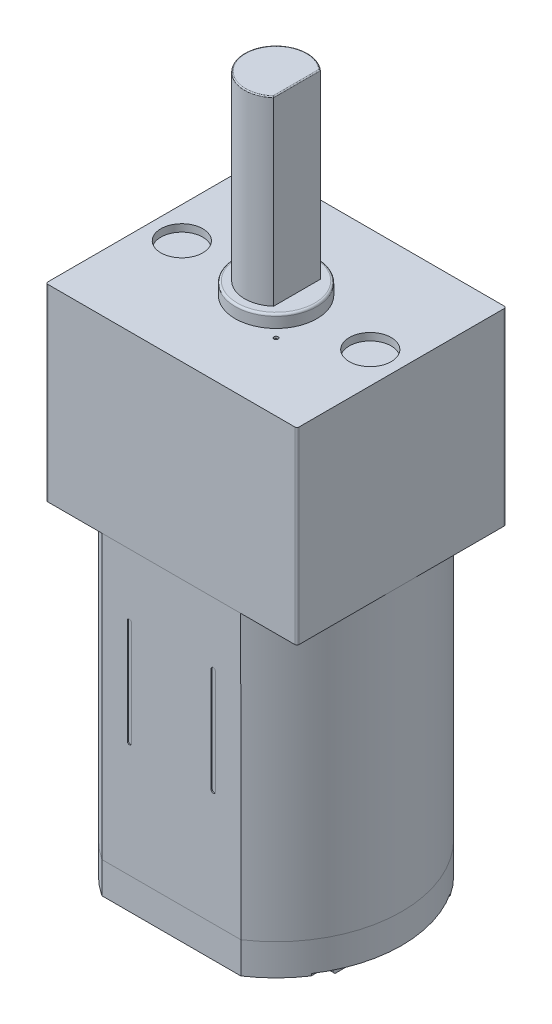
from build123d import *

# Parameters (mm, degrees)
EXTRUDE_1_DEPTH     = 13.5
SKETCH_2_W          = 12
SKETCH_2_H          = 10
EXTRUDE_2_DEPTH     = 9
SKETCH_3_R          = 1.95
EXTRUDE_3_DEPTH     = 0.6
EXTRUDE_4_DEPTH     = 8.67
SKETCH_5_R          = 1
CUT_EXTRUDE_1_DEPTH = 0.35
FILLET_1_R          = 0.1
EXTRUDE_6_DEPTH     = 1.4
EXTRUDE_START       = 0.1
EXTRUDE_7_DEPTH     = 0.1
SKETCH_8_W          = 0.3
SKETCH_8_H          = 1.5
EXTRUDE_8_DEPTH     = 2
CHAMFER_1_SIZE      = 0.1
SKETCH_9_R          = 0.4
CUT_EXTRUDE_2_DEPTH = 7
SKETCH_10_R         = 2.5
EXTRUDE_9_DEPTH     = 2
FILLET_2_R          = 0.2
SKETCH_11_R         = 0.1
CUT_EXTRUDE_3_DEPTH = 0.7
FILLET_3_R          = 0.1
CUT_EXTRUDE_4_DEPTH = 0.05
FILLET_4_R          = 0.05
FILLET_5_R          = 0.1


with BuildPart() as part:
    # Эскиз1 → Бобышка-Вытянуть1 (new body)
    with BuildSketch(Plane(origin=(0, 0, 0), x_dir=(1, 0, 0), z_dir=(0, 1, 0))):
        with BuildLine():
            Line((-3.31662479, 5), (3.31662479, 5))
            ThreePointArc((3.31662479, 5), (6, 0), (3.31662479, -5))
            Line((3.31662479, -5), (-3.31662479, -5))
            ThreePointArc((-3.31662479, -5), (-6, 0), (-3.31662479, 5))
        make_face()
    extrude(amount=EXTRUDE_1_DEPTH)

    # Эскиз2 → Бобышка-Вытянуть2 (add)
    with BuildSketch(Plane(origin=(0, 13.5, 0), x_dir=(1, 0, 0), z_dir=(0, 1, 0))):
        with Locations((0, -0.001677367)):
            Rectangle(SKETCH_2_W, SKETCH_2_H)
    extrude(amount=EXTRUDE_2_DEPTH)

    # Эскиз3 → Бобышка-Вытянуть3 (add)
    with BuildSketch(Plane(origin=(0, 22.5, 0), x_dir=(1, 0, 0), z_dir=(0, 1, 0))):
        with Locations(Location((0, 0, 0), (0, 0, 270))):
            Circle(SKETCH_3_R)
    extrude(amount=EXTRUDE_3_DEPTH)

    # Эскиз4 → Бобышка-Вытянуть4 (add)
    with BuildSketch(Plane(origin=(0, 23.1, 0), x_dir=(1, 0, 0), z_dir=(0, 1, 0))):
        with BuildLine():
            Line((1, 1.118033989), (1, -1.118033989))
            ThreePointArc((1, -1.118033989), (-1.5, 0), (1, 1.118033989))
        make_face()
    extrude(amount=EXTRUDE_4_DEPTH)

    # Эскиз5 → Вырез-Вытянуть1 (cut)
    with BuildSketch(Plane(origin=(0, 22.5, 0), x_dir=(1, 0, 0), z_dir=(0, 1, 0))):
        with Locations(Location((-4.5, 0, 0), (0, 0, 270))):
            Circle(SKETCH_5_R)
        with Locations(Location((4.5, 0, 0), (0, 0, 90))):
            Circle(SKETCH_5_R)
    extrude(amount=-CUT_EXTRUDE_1_DEPTH, mode=Mode.SUBTRACT)

    # Скругление1
    fillet_1_edges = [part.edges().sort_by_distance(p)[0] for p in [
        (-6, 18, 5.001677367),
        (6, 18, 5.001677367),
        (6, 18, -4.998322633),
        (-6, 18, -4.998322633),
    ]]
    fillet(fillet_1_edges, radius=FILLET_1_R)

    # Эскиз11 → Вырез-Вытянуть3 (cut)
    with BuildSketch(Plane(origin=(0, 23.1, 0), x_dir=(1, 0, 0), z_dir=(0, 1, 0))):
        with Locations(Location((1.767766953, -1.767766953, 0), (0, 0, 270))):
            Circle(SKETCH_11_R)
        with Locations(Location((-1.767766953, 1.767766953, 0), (0, 0, 270))):
            Circle(SKETCH_11_R)
    extrude(amount=-CUT_EXTRUDE_3_DEPTH, mode=Mode.SUBTRACT)

    # Эскиз12 → Вырез-Вытянуть4 (cut)
    with BuildSketch(Plane(origin=(0, 0, -5), x_dir=(-1, 0, 0), z_dir=(0, 0, -1))):
        with BuildLine():
            Line((1.9, 5.5), (1.9, 10.5))
            ThreePointArc((1.9, 10.5), (2, 10.6), (2.1, 10.5))
            Line((2.1, 10.5), (2.1, 5.5))
            ThreePointArc((2.1, 5.5), (2, 5.4), (1.9, 5.5))
        make_face()
        with BuildLine():
            Line((-2.1, 5.5), (-2.1, 10.5))
            ThreePointArc((-2.1, 10.5), (-2, 10.6), (-1.9, 10.5))
            Line((-1.9, 10.5), (-1.9, 5.5))
            ThreePointArc((-1.9, 5.5), (-2, 5.4), (-2.1, 5.5))
        make_face()
    cut_extrude_4 = extrude(amount=-CUT_EXTRUDE_4_DEPTH, mode=Mode.SUBTRACT)

    # Зеркальное отражение1: Вырез-Вытянуть4 across plane
    add(cut_extrude_4.mirror(Plane(origin=(0, 0, 0), x_dir=(1, 0, 0), z_dir=(0, 0, -1))), mode=Mode.SUBTRACT)

    # Скругление4
    fillet_4_edges = [part.edges().sort_by_distance(p)[0] for p in [
        (-1.5, 31.77, 0),
        (1, 31.77, 0),
    ]]
    fillet(fillet_4_edges, radius=FILLET_4_R)

    # Скругление5
    fillet_5_edges = [part.edges().sort_by_distance(p)[0] for p in [
        (0, 23.1, -1.95),
    ]]
    fillet(fillet_5_edges, radius=FILLET_5_R)


with BuildPart() as body_2:
    # Эскиз6 → Бобышка-Вытянуть6 (new body)
    with BuildSketch(Plane.XZ):
        with BuildLine():
            Line((-3.31662479, -5), (3.31662479, -5))
            ThreePointArc((3.31662479, -5), (6, 0), (3.31662479, 5))
            Line((3.31662479, 5), (-3.31662479, 5))
            ThreePointArc((-3.31662479, 5), (-6, 0), (-3.31662479, -5))
        make_face()
    extrude(amount=EXTRUDE_6_DEPTH)

    # Эскиз7 → Бобышка-Вытянуть7 (add)
    with BuildSketch(Plane(origin=(0, -1.4, 0), x_dir=(-1, 0, 0), z_dir=(0, -1, 0)).offset(EXTRUDE_START)):
        with BuildLine():
            ThreePointArc((3.31662479, -5), (4.242640687, -4.242640687), (5, -3.31662479))
            Line((5, -3.31662479), (5, 3.31662479))
            ThreePointArc((5, 3.31662479), (4.242640687, 4.242640687), (3.31662479, 5))
            Line((3.31662479, 5), (-3.31662479, 5))
            ThreePointArc((-3.31662479, 5), (-4.242640687, 4.242640687), (-5, 3.31662479))
            Line((-5, 3.31662479), (-5, -3.31662479))
            ThreePointArc((-5, -3.31662479), (-4.242640687, -4.242640687), (-3.31662479, -5))
            Line((-3.31662479, -5), (3.31662479, -5))
        make_face()
    extrude(amount=-EXTRUDE_7_DEPTH)

    # Эскиз8 → Бобышка-Вытянуть8 (add)
    with BuildSketch(Plane(origin=(0, -1.5, 0), x_dir=(-1, 0, 0), z_dir=(0, -1, 0))):
        with Locations((3.315, 0)):
            Rectangle(SKETCH_8_W, SKETCH_8_H)
        with Locations((-3.315, 0)):
            Rectangle(SKETCH_8_W, SKETCH_8_H)
    extrude(amount=EXTRUDE_8_DEPTH)

    # Фаска1
    chamfer_1_edges = [body_2.edges().sort_by_distance(p)[0] for p in [
        (-3.315, -3.5, -0.75),
        (-3.315, -3.5, 0.75),
        (3.315, -3.5, 0.75),
        (3.315, -3.5, -0.75),
    ]]
    chamfer(chamfer_1_edges, length=CHAMFER_1_SIZE)

    # Эскиз9 → Вырез-Вытянуть2 (cut)
    with BuildSketch(Plane.ZY.offset(3.465)):
        with Locations((0, -2.5)):
            Circle(SKETCH_9_R)
    extrude(amount=-CUT_EXTRUDE_2_DEPTH, mode=Mode.SUBTRACT)

    # Эскиз10 → Бобышка-Вытянуть9 (add)
    with BuildSketch(Plane(origin=(0, -1.5, 0), x_dir=(-1, 0, 0), z_dir=(0, -1, 0))):
        with Locations(Location((0, 0, 0), (0, 0, 90))):
            Circle(SKETCH_10_R)
    extrude(amount=EXTRUDE_9_DEPTH)

    # Скругление2
    fillet_2_edges = [body_2.edges().sort_by_distance(p)[0] for p in [
        (0, -3.5, 2.5),
    ]]
    fillet(fillet_2_edges, radius=FILLET_2_R)

    # Скругление3
    fillet_3_edges = [body_2.edges().sort_by_distance(p)[0] for p in [
        (0, -1.5, 2.5),
    ]]
    fillet(fillet_3_edges, radius=FILLET_3_R)


solid = Compound([part.part, body_2.part])
